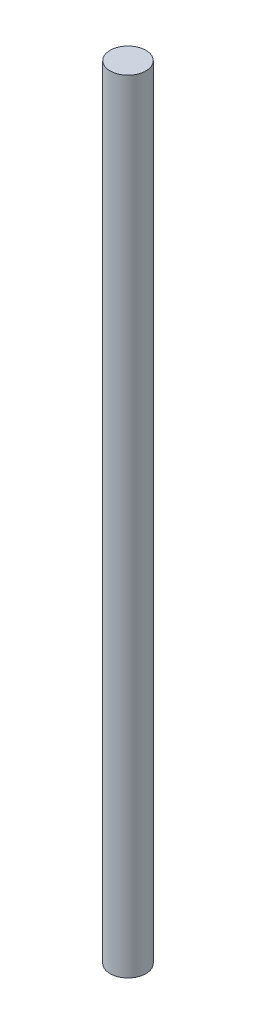
from build123d import *

# Parameters (mm, degrees)
ESBO_O1_R                = 4
RESSALTO_EXTRUS_O1_DEPTH = 175


with BuildPart() as part:
    # Esboço1 → Ressalto-extrusão1 (new body)
    with BuildSketch(Plane(origin=(0, 0, 0), x_dir=(1, 0, 0), z_dir=(0, 1, 0))):
        with Locations(Location((0, 0, 0), (0, 0, 270))):
            Circle(ESBO_O1_R)
    extrude(amount=RESSALTO_EXTRUS_O1_DEPTH)


solid = part.part
